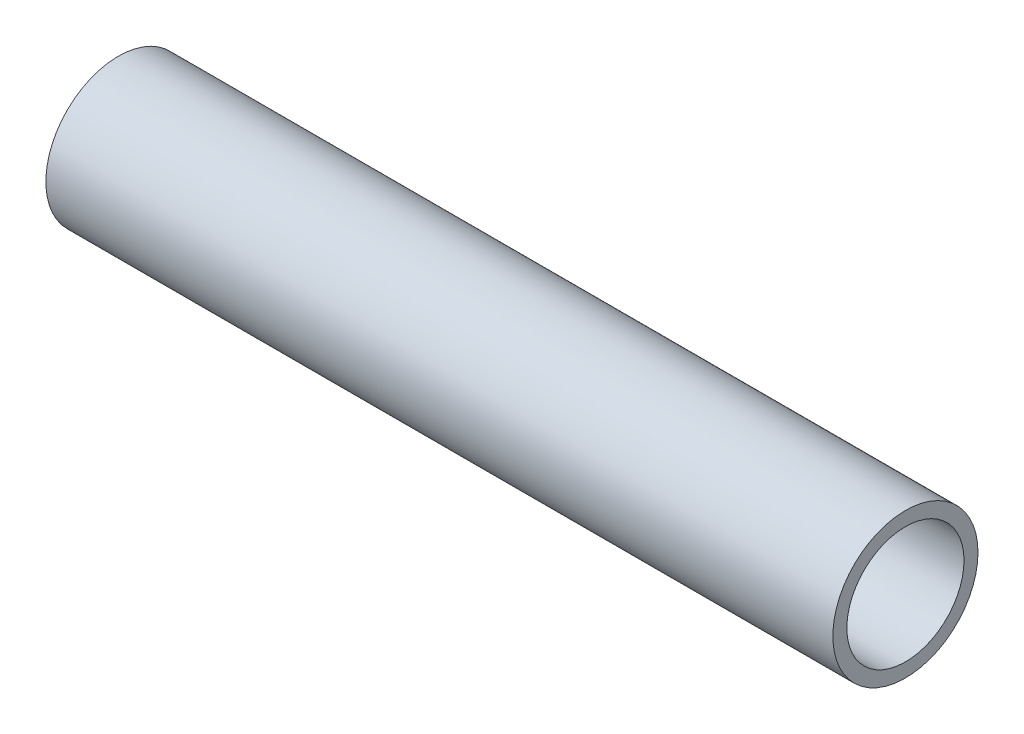
from build123d import *

# Parameters (mm, degrees)
SKETCH1_R           = 21.082
SKETCH1_R_2         = 17.018
BOSS_EXTRUDE1_DEPTH = 228.6


with BuildPart() as part:
    # Sketch1 → Boss-Extrude1 (new body)
    with BuildSketch(Plane(origin=(0, 0, 0), x_dir=(0, 0, -1), z_dir=(1, 0, 0))):
        Circle(SKETCH1_R)
        Circle(SKETCH1_R_2, mode=Mode.SUBTRACT)
    extrude(amount=BOSS_EXTRUDE1_DEPTH)


solid = part.part
